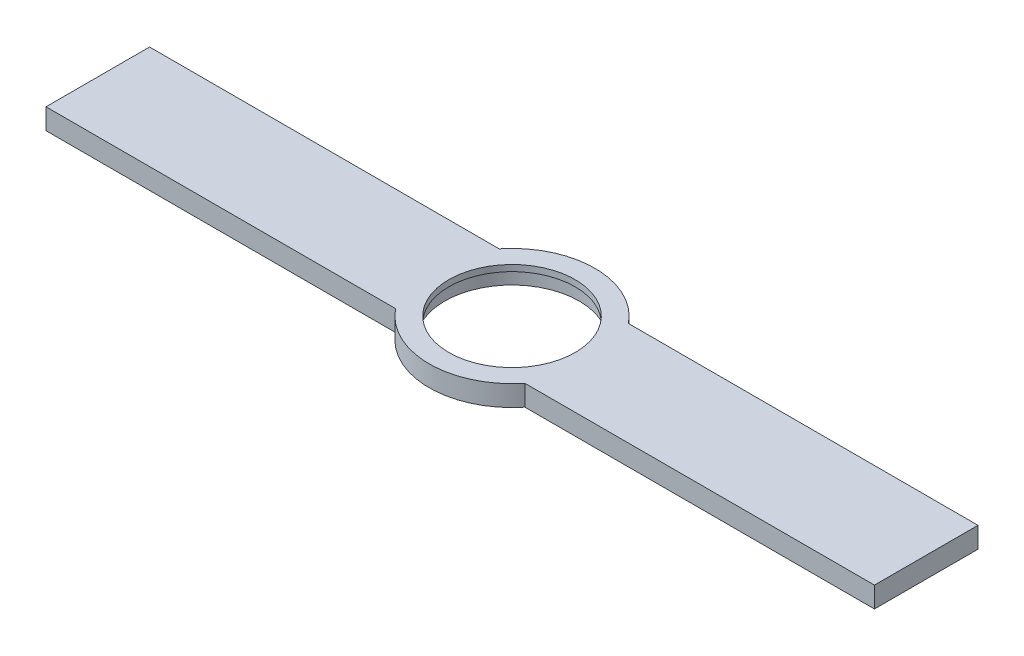
from build123d import *

# Parameters (mm, degrees)
BOSS_EXTRUDE1_DEPTH = 10
CUT_EXTRUDE3_REACH  = 206.206
SKETCH4_R           = 30.5
SKETCH3_R           = 32.5
CUT_EXTRUDE4_DEPTH  = 7


with BuildPart() as part:
    # Sketch1 → Boss-Extrude1 (new body)
    with BuildSketch(Plane(origin=(0, 0, 0), x_dir=(1, 0, 0), z_dir=(0, 1, 0))):
        with BuildLine():
            ThreePointArc((31.224989992, 25), (0, 40), (-31.224989992, 25))
            Line((-31.224989992, 25), (31.224989992, 25))
        make_face()
        with BuildLine():
            Line((31.224989992, 25), (-31.224989992, 25))
            ThreePointArc((-31.224989992, 25), (-40, 0), (-31.224989992, -25))
            Line((-31.224989992, -25), (31.224989992, -25))
            ThreePointArc((31.224989992, -25), (37.742546282, -13.247648854), (40, 0))
            ThreePointArc((40, 0), (37.742546282, 13.247648854), (31.224989992, 25))
        make_face()
        with BuildLine():
            Line((-31.224989992, 25), (-200, 25))
            Line((-200, 25), (-200, -25))
            Line((-200, -25), (-31.224989992, -25))
            ThreePointArc((-31.224989992, -25), (-40, 0), (-31.224989992, 25))
        make_face()
        with BuildLine():
            Line((200, 25), (31.224989992, 25))
            ThreePointArc((31.224989992, 25), (37.742546282, 13.247648854), (40, 0))
            ThreePointArc((40, 0), (37.742546282, -13.247648854), (31.224989992, -25))
            Line((31.224989992, -25), (200, -25))
            Line((200, -25), (200, 25))
        make_face()
        with BuildLine():
            Line((31.224989992, -25), (-31.224989992, -25))
            ThreePointArc((-31.224989992, -25), (0, -40), (31.224989992, -25))
        make_face()
    extrude(amount=BOSS_EXTRUDE1_DEPTH)

    # Sketch4 → Cut-Extrude3 (cut, up to next)
    with BuildSketch(Plane(origin=(0, 10, 0), x_dir=(1, 0, 0), z_dir=(0, 1, 0)), mode=Mode.PRIVATE) as cut_extrude3_sk1:
        with Locations(Location((0, 0, 0), (0, 0, 270))):
            Circle(SKETCH4_R)
    cut_extrude3_tool1 = extrude(cut_extrude3_sk1.sketch, amount=-CUT_EXTRUDE3_REACH, mode=Mode.PRIVATE) & part.part
    add(cut_extrude3_tool1.solids().sort_by_distance((0, 10, 0))[0], mode=Mode.SUBTRACT)

    # Sketch3 → Cut-Extrude4 (cut)
    with BuildSketch(Plane.XZ):
        with Locations(Location((0, 0, 0), (0, 0, 270))):
            Circle(SKETCH3_R)
    extrude(amount=-CUT_EXTRUDE4_DEPTH, mode=Mode.SUBTRACT)


solid = part.part
